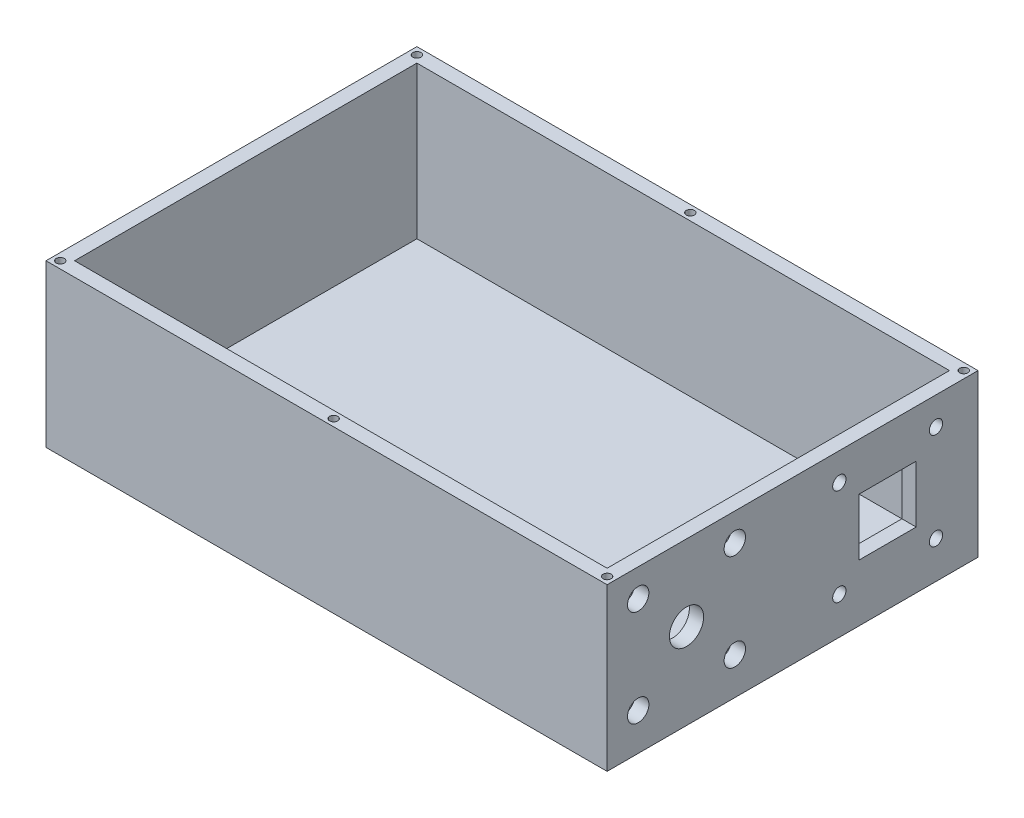
from build123d import *

# Parameters (mm, degrees)
SKETCH1_W           = 118
SKETCH1_H           = 78
MAIN_BOX_UP_DEPTH   = 34
SKETCH2_W           = 112
SKETCH2_H           = 72
MAIN_BOX_INTO_DEPTH = 32
SKETCH4_R           = 1.4
SKETCH4_W           = 12
SKETCH4_H           = 12
GPS_DEPTH           = 3
SKETCH5_R           = 2.25
SKETCH5_R_2         = 3.6
CUT_EXTRUDE3_DEPTH  = 3
SKETCH6_R           = 0.85
CUT_EXTRUDE4_DEPTH  = 4


with BuildPart() as part:
    # Sketch1 → Main Box Up (new body)
    with BuildSketch(Plane(origin=(0, 0, 0), x_dir=(1, 0, 0), z_dir=(0, 1, 0))):
        Rectangle(SKETCH1_W, SKETCH1_H)
    extrude(amount=MAIN_BOX_UP_DEPTH)

    # Sketch2 → Main Box Into (cut)
    with BuildSketch(Plane(origin=(0, 34, 0), x_dir=(1, 0, 0), z_dir=(0, 1, 0))):
        Rectangle(SKETCH2_W, SKETCH2_H)
    extrude(amount=-MAIN_BOX_INTO_DEPTH, mode=Mode.SUBTRACT)

    # Sketch4 → GPS (cut)
    with BuildSketch(Plane.ZY.offset(-56)):
        with Locations((-30.16, 28.16)):
            Circle(SKETCH4_R)
        with Locations((-9.84, 28.16)):
            Circle(SKETCH4_R)
        with Locations((-30.16, 7.84)):
            Circle(SKETCH4_R)
        with Locations((-9.84, 7.84)):
            Circle(SKETCH4_R)
        with Locations((-20, 18)):
            Rectangle(SKETCH4_W, SKETCH4_H)
    extrude(amount=-GPS_DEPTH, mode=Mode.SUBTRACT)

    # Sketch5 → Cut-Extrude3 (cut)
    with BuildSketch(Plane.ZY.offset(-56)):
        with Locations((12.14, 28.16)):
            Circle(SKETCH5_R)
        with Locations((32.46, 28.16)):
            Circle(SKETCH5_R)
        with Locations((12.14, 7.84)):
            Circle(SKETCH5_R)
        with Locations((32.46, 7.84)):
            Circle(SKETCH5_R)
        with Locations((22.3, 18)):
            Circle(SKETCH5_R_2)
    extrude(amount=-CUT_EXTRUDE3_DEPTH, mode=Mode.SUBTRACT)

    # Sketch6 → Cut-Extrude4 (cut)
    with BuildSketch(Plane(origin=(0, 34, 0), x_dir=(1, 0, 0), z_dir=(0, 1, 0))):
        with Locations(Location((-57.5, 37.5, 0), (0, 0, 270))):
            Circle(SKETCH6_R)
        with Locations(Location((-57.5, -37.5, 0), (0, 0, 270))):
            Circle(SKETCH6_R)
        with Locations(Location((57.5, -37.5, 0), (0, 0, 270))):
            Circle(SKETCH6_R)
        with Locations(Location((57.5, 37.5, 0), (0, 0, 270))):
            Circle(SKETCH6_R)
        with Locations(Location((0, 37.5, 0), (0, 0, 270))):
            Circle(SKETCH6_R)
        with Locations(Location((0, -37.5, 0), (0, 0, 270))):
            Circle(SKETCH6_R)
    extrude(amount=-CUT_EXTRUDE4_DEPTH, mode=Mode.SUBTRACT)


solid = part.part
